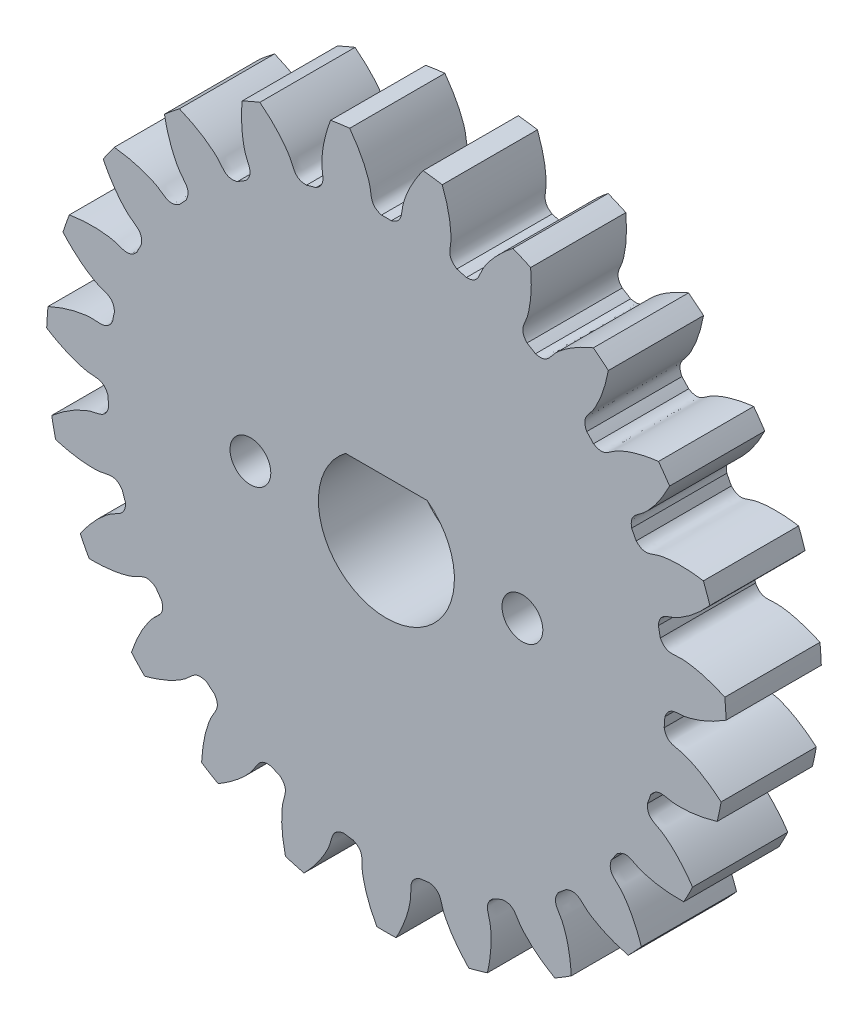
from build123d import *

# Parameters (mm, degrees)
SKETCH_1_R               = 25
EXTRUDE_1_DEPTH          = 7
CUT_EXTRUDE_1_DEPTH      = 37.041642582
PATTERN_CIRCULAR_1_COUNT = 23
CUT_EXTRUDE_2_DEPTH      = 7
SKETCH_9_R               = 1.5
CUT_EXTRUDE_3_DEPTH      = 37.027836921
CHAMFER_1_SIZE           = 1.5


with BuildPart() as part:
    # 草图1 → 凸台-拉伸1 (new body)
    with BuildSketch(Plane.XY):
        Circle(SKETCH_1_R)
    extrude(amount=EXTRUDE_1_DEPTH)

    # 草图2 → 切除-拉伸1 (cut, through all)
    with BuildSketch(Plane.XY):
        with BuildLine():
            ThreePointArc((0.362755305, 20.496790202), (0, 20.5), (-0.362755305, 20.496790202))
            add(Edge.make_bspline(
                [(-0.362755305, 20.496790202), (-1.155466972, 20.733525948), (-1.087520616, 21.26767434), (-1.185859869, 21.794351938), (-1.198995845, 21.857849297), (-1.215324159, 21.929500041), (-1.235163177, 22.009201186), (-1.258844493, 22.096836763), (-1.286691262, 22.192281901), (-1.319024726, 22.295401644), (-1.356161833, 22.406051438), (-1.398415633, 22.524077112), (-1.446094819, 22.649315017), (-1.499503533, 22.781592128), (-1.5589411, 22.920726165), (-1.624701785, 23.066525721), (-1.697074541, 23.218790386), (-1.776342776, 23.377310889), (-1.862784108, 23.541869241), (-1.956670134, 23.71223888), (-2.058266195, 23.888184833), (-2.167831155, 24.069463867), (-2.28561717, 24.255824664), (-2.411869476, 24.447007991), (-2.546826167, 24.642746874), (-2.690717991, 24.842766783), (-2.843768139, 25.046785824), (-3.006192046, 25.254514926), (-3.178197192, 25.465658044), (-3.359982914, 25.679912362), (-3.551740212, 25.8969685), (-3.753651576, 26.116510729), (-3.965890802, 26.338217186), (-4.188622824, 26.561760101), (-4.422003548, 26.786806019), (-4.666179691, 27.013016034), (-4.921288623, 27.240046023), (-5.18745824, 27.467546885), (-5.464806735, 27.695164787), (-5.854182413, 28.001900287), (-6.156580907, 28.225592313), (-6.363361531, 28.372391104)],
                knots=[0, 0, 0, 0, 0.147386897, 0.152959532, 0.159389495, 0.166676786, 0.174821406, 0.183823355, 0.193682632, 0.204399237, 0.21597317, 0.228404432, 0.241693023, 0.255838942, 0.270842189, 0.286702764, 0.303420668, 0.320995901, 0.339428462, 0.358718351, 0.378865568, 0.399870114, 0.421731989, 0.444451192, 0.468027723, 0.492461582, 0.517752771, 0.543901287, 0.570907132, 0.598770305, 0.627490807, 0.657068637, 0.687503795, 0.718796282, 0.750946098, 0.783953241, 0.817817713, 0.852539514, 0.888118643, 0.9245551, 1, 1, 1, 1], degree=3))
            ThreePointArc((-6.363361531, 28.372391104), (0, 29.077223852), (6.363361531, 28.372391104))
            add(Edge.make_bspline(
                [(0.362755305, 20.496790202), (1.155466972, 20.733525948), (1.087520616, 21.26767434), (1.185859869, 21.794351938), (1.198995845, 21.857849297), (1.215324159, 21.929500041), (1.235163177, 22.009201186), (1.258844493, 22.096836763), (1.286691262, 22.192281901), (1.319024726, 22.295401644), (1.356161833, 22.406051438), (1.398415633, 22.524077112), (1.446094819, 22.649315017), (1.499503533, 22.781592128), (1.5589411, 22.920726165), (1.624701785, 23.066525721), (1.697074541, 23.218790386), (1.776342776, 23.377310889), (1.862784108, 23.541869241), (1.956670134, 23.71223888), (2.058266195, 23.888184833), (2.167831155, 24.069463867), (2.28561717, 24.255824664), (2.411869476, 24.447007991), (2.546826167, 24.642746874), (2.690717991, 24.842766783), (2.843768139, 25.046785824), (3.006192046, 25.254514926), (3.178197192, 25.465658044), (3.359982914, 25.679912362), (3.551740212, 25.8969685), (3.753651576, 26.116510729), (3.965890802, 26.338217186), (4.188622824, 26.561760101), (4.422003548, 26.786806019), (4.666179691, 27.013016034), (4.921288623, 27.240046023), (5.18745824, 27.467546885), (5.464806735, 27.695164787), (5.854182413, 28.001900287), (6.156580907, 28.225592313), (6.363361531, 28.372391104)],
                knots=[0, 0, 0, 0, 0.147386897, 0.152959532, 0.159389495, 0.166676786, 0.174821406, 0.183823355, 0.193682632, 0.204399237, 0.21597317, 0.228404432, 0.241693023, 0.255838942, 0.270842189, 0.286702764, 0.303420668, 0.320995901, 0.339428462, 0.358718351, 0.378865568, 0.399870114, 0.421731989, 0.444451192, 0.468027723, 0.492461582, 0.517752771, 0.543901287, 0.570907132, 0.598770305, 0.627490807, 0.657068637, 0.687503795, 0.718796282, 0.750946098, 0.783953241, 0.817817713, 0.852539514, 0.888118643, 0.9245551, 1, 1, 1, 1], degree=3))
        make_face()
    cut_extrude_1 = extrude(amount=CUT_EXTRUDE_1_DEPTH, mode=Mode.SUBTRACT)

    # 阵列(圆周)1: 切除-拉伸1 ×23 about axis
    pattern_circular_1_axis = Axis((0, 0, 7), (0, 0, -1))
    for i in range(1, PATTERN_CIRCULAR_1_COUNT):
        add(cut_extrude_1.rotate(pattern_circular_1_axis, i * 360 / PATTERN_CIRCULAR_1_COUNT), mode=Mode.SUBTRACT)

    # 草图4 → 切除-拉伸2 (cut)
    with BuildSketch(Plane.XY.offset(7)):
        with BuildLine():
            Line((-3, 4), (3, 4))
            ThreePointArc((3, 4), (0, -5), (-3, 4))
        make_face()
    extrude(amount=-CUT_EXTRUDE_2_DEPTH, mode=Mode.SUBTRACT)

    # 草图9 → 切除-拉伸3 (cut, through all)
    with BuildSketch(Plane(origin=(0, 0, 0), x_dir=(-1, 0, 0), z_dir=(0, 0, -1))):
        with Locations((-10, 0)):
            Circle(SKETCH_9_R)
        with Locations((10, 0)):
            Circle(SKETCH_9_R)
    extrude(amount=-CUT_EXTRUDE_3_DEPTH, mode=Mode.SUBTRACT)

    # 倒角1
    chamfer_1_edges = [part.edges().sort_by_distance(p)[0] for p in [
        (11.5, 0, 0),
        (-8.5, 0, 0),
    ]]
    chamfer(chamfer_1_edges, length=CHAMFER_1_SIZE)


solid = part.part
